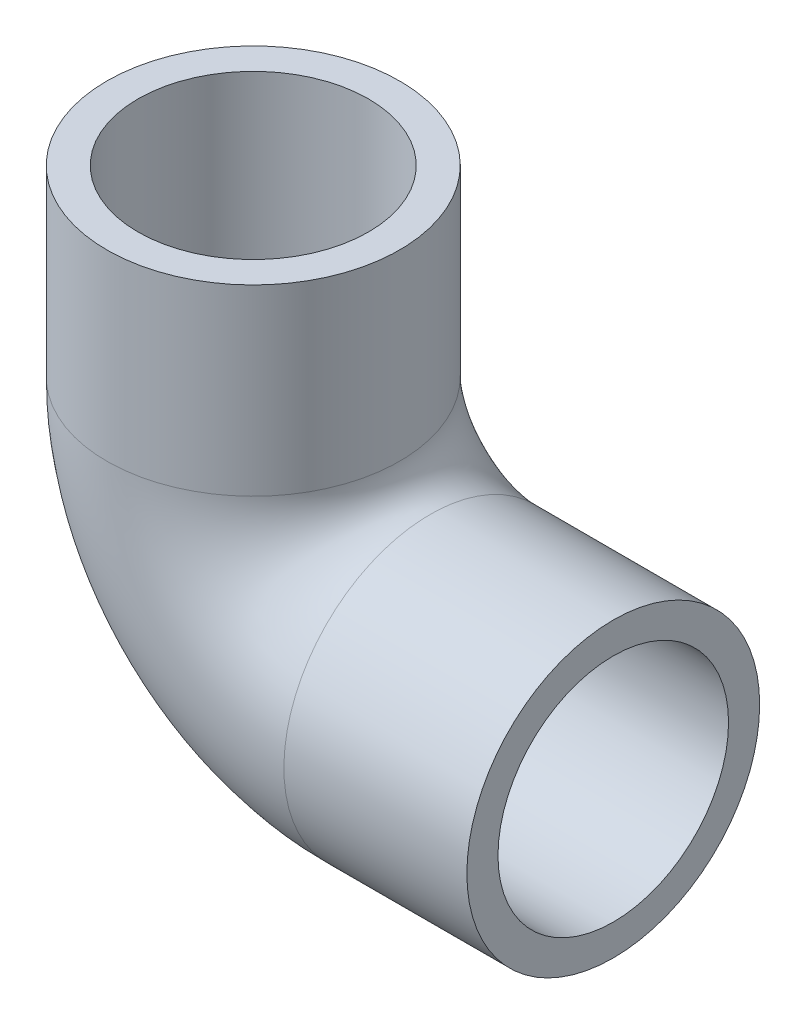
from build123d import *

# Parameters (mm, degrees)
SKETCH1_R           = 10.16
SKETCH1_R_2         = 6.35
REVOLVE1_ANGLE      = 90
SKETCH2_R           = 10.16
SKETCH2_R_2         = 8.001
BOSS_EXTRUDE1_DEPTH = 12.7
SKETCH3_R           = 10.16
SKETCH3_R_2         = 8.001
BOSS_EXTRUDE2_DEPTH = 12.7


with BuildPart() as part:
    # Sketch1 → Revolve1 (revolve)
    with BuildSketch(Plane(origin=(0, 0, 0), x_dir=(0, 0, -1), z_dir=(1, 0, 0))):
        Circle(SKETCH1_R)
        Circle(SKETCH1_R_2, mode=Mode.SUBTRACT)
    revolve(axis=Axis((0, 12.286198988, 1000.032631209), (0, 0, -1)), revolution_arc=REVOLVE1_ANGLE)

    # Sketch2 → Boss-Extrude1 (add)
    with BuildSketch(Plane(origin=(0, 12.286198988, 0), x_dir=(1, 0, 0), z_dir=(0, 1, 0))):
        with Locations(Location((-12.286198988, 0, 0), (0, 0, 180))):
            Circle(SKETCH2_R)
        with Locations(Location((-12.286198988, 0, 0), (0, 0, 180))):
            Circle(SKETCH2_R_2, mode=Mode.SUBTRACT)
    extrude(amount=BOSS_EXTRUDE1_DEPTH)

    # Sketch3 → Boss-Extrude2 (add)
    with BuildSketch(Plane(origin=(0, 0, 0), x_dir=(0, 0, -1), z_dir=(1, 0, 0))):
        with Locations(Location((0, 0, 0), (0, 0, 270))):
            Circle(SKETCH3_R)
        Circle(SKETCH3_R_2, mode=Mode.SUBTRACT)
    extrude(amount=BOSS_EXTRUDE2_DEPTH)


solid = part.part
